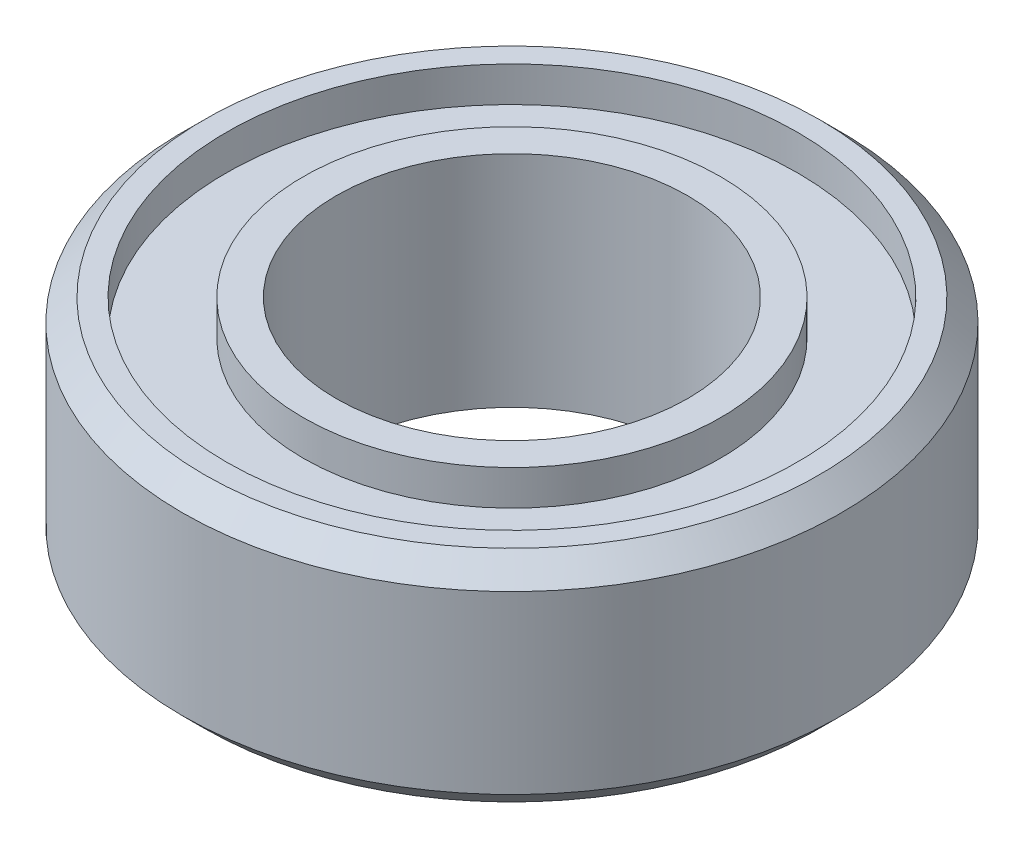
from build123d import *

# Parameters (mm, degrees)
SKETCH_1_R          = 7.5
SKETCH_1_R_2        = 4
EXTRUDE_1_DEPTH     = 5
CHAMFER_1_SIZE      = 0.5
CHAMFER_2_SIZE      = 0.5
SKETCH_2_R          = 6.5
SKETCH_2_R_2        = 4.75
CUT_EXTRUDE_1_DEPTH = 0.8
CUT_EXTRUDE_START   = -0.8
SKETCH_3_R          = 6.5
SKETCH_3_R_2        = 4.75
CUT_EXTRUDE_2_DEPTH = 0.8


with BuildPart() as part:
    # 草图1 → 凸台-拉伸1 (new body)
    with BuildSketch(Plane(origin=(0, 0, 0), x_dir=(1, 0, 0), z_dir=(0, 1, 0))):
        with Locations(Location((0, 0, 0), (0, 0, 270))):
            Circle(SKETCH_1_R)
        with Locations(Location((0, 0, 0), (0, 0, 270))):
            Circle(SKETCH_1_R_2, mode=Mode.SUBTRACT)
    extrude(amount=EXTRUDE_1_DEPTH)

    # 倒角1
    chamfer_1_edges = [part.edges().sort_by_distance(p)[0] for p in [
        (0, 5, -7.5),
    ]]
    chamfer(chamfer_1_edges, length=CHAMFER_1_SIZE)

    # 倒角2
    chamfer_2_edges = [part.edges().sort_by_distance(p)[0] for p in [
        (0, 0, -7.5),
    ]]
    chamfer(chamfer_2_edges, length=CHAMFER_2_SIZE)

    # 草图2 → 切除-拉伸1 (cut)
    with BuildSketch(Plane(origin=(0, 5, 0), x_dir=(1, 0, 0), z_dir=(0, 1, 0))):
        with Locations(Location((0, 0, 0), (0, 0, 270))):
            Circle(SKETCH_2_R)
        with Locations(Location((0, 0, 0), (0, 0, 270))):
            Circle(SKETCH_2_R_2, mode=Mode.SUBTRACT)
    extrude(amount=-CUT_EXTRUDE_1_DEPTH, mode=Mode.SUBTRACT)

    # 草图3 → 切除-拉伸2 (cut)
    with BuildSketch(Plane.XZ.offset(CUT_EXTRUDE_START)):
        with Locations(Location((0, 0, 0), (0, 0, 90))):
            Circle(SKETCH_3_R)
        with Locations(Location((0, 0, 0), (0, 0, 90))):
            Circle(SKETCH_3_R_2, mode=Mode.SUBTRACT)
    extrude(amount=CUT_EXTRUDE_2_DEPTH, mode=Mode.SUBTRACT)


solid = part.part
